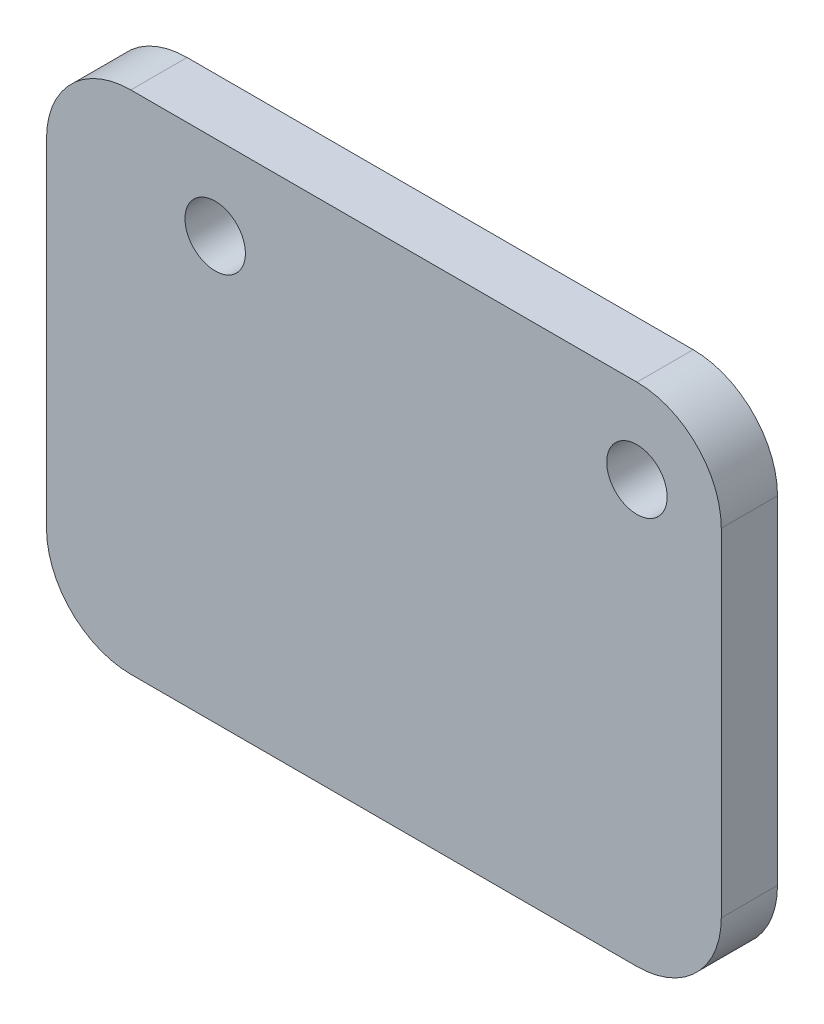
from build123d import *

# Parameters (mm, degrees)
SKETCH_1_W      = 24
SKETCH_1_H      = 18
SKETCH_1_R      = 1.075
EXTRUDE_1_DEPTH = 2
FILLET_1_R      = 3
FILLET_2_R      = 3
FILLET_3_R      = 3
FILLET_4_R      = 3


with BuildPart() as part:
    # 草图1 → 凸台-拉伸1 (new body)
    with BuildSketch(Plane.XY):
        with Locations((12, -9)):
            Rectangle(SKETCH_1_W, SKETCH_1_H)
        with Locations((21, -3)):
            Circle(SKETCH_1_R, mode=Mode.SUBTRACT)
        with Locations((6, -3)):
            Circle(SKETCH_1_R, mode=Mode.SUBTRACT)
    extrude(amount=EXTRUDE_1_DEPTH)

    # 圆角1
    fillet_1_edges = [part.edges().sort_by_distance(p)[0] for p in [
        (24, 0, 1),
    ]]
    fillet(fillet_1_edges, radius=FILLET_1_R)

    # 圆角2
    fillet_2_edges = [part.edges().sort_by_distance(p)[0] for p in [
        (0, 0, 1),
    ]]
    fillet(fillet_2_edges, radius=FILLET_2_R)

    # 圆角3
    fillet_3_edges = [part.edges().sort_by_distance(p)[0] for p in [
        (0, -18, 1),
    ]]
    fillet(fillet_3_edges, radius=FILLET_3_R)

    # 圆角4
    fillet_4_edges = [part.edges().sort_by_distance(p)[0] for p in [
        (24, -18, 1),
    ]]
    fillet(fillet_4_edges, radius=FILLET_4_R)


solid = part.part
